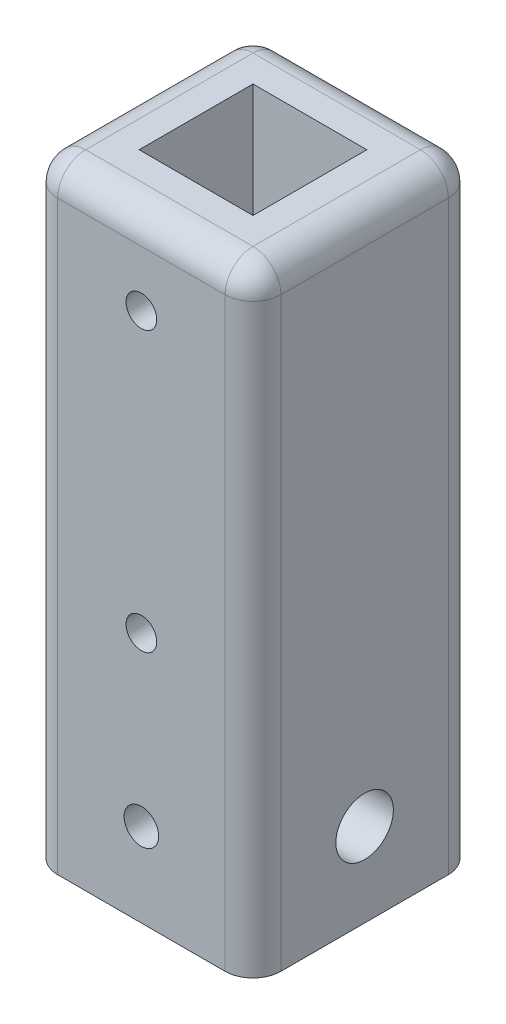
from build123d import *

# Parameters (mm, degrees)
SKETCH1_W               = 40
SKETCH1_H               = 40
SKETCH1_W_2             = 20.4
SKETCH1_H_2             = 20.4
BOSS_EXTRUDE1_DEPTH     = 80
SKETCH1_2_W             = 40
SKETCH1_2_H             = 40
BOSS_EXTRUDE2_DEPTH     = 30
CUT_EXTRUDE1_DEPTH      = 91.68671347
CUT_EXTRUDE1_DEPTH_BACK = 91.68671347
SKETCH2_R               = 2.75
SKETCH3_R               = 5.15
CUT_EXTRUDE4_DEPTH      = 95.403601626
FILLET1_R               = 5
SKETCH4_R               = 3.1
CUT_EXTRUDE6_DEPTH      = 10.5
SKETCH4_3_R             = 2.75
CUT_EXTRUDE7_DEPTH      = 20
FILLET2_R               = 5


with BuildPart() as part:
    # Sketch1 → Boss-Extrude1 (new body)
    with BuildSketch(Plane(origin=(0, 0, 0), x_dir=(1, 0, 0), z_dir=(0, 1, 0))):
        with Locations((10.2, 10.2)):
            Rectangle(SKETCH1_W, SKETCH1_H)
        with Locations((10.2, 10.2)):
            Rectangle(SKETCH1_W_2, SKETCH1_H_2, mode=Mode.SUBTRACT)
    extrude(amount=BOSS_EXTRUDE1_DEPTH)

    # Sketch1<2> → Boss-Extrude2 (add)
    with BuildSketch(Plane(origin=(0, 0, 0), x_dir=(1, 0, 0), z_dir=(0, 1, 0))):
        with Locations((10.2, 10.2)):
            Rectangle(SKETCH1_2_W, SKETCH1_2_H)
    extrude(amount=-BOSS_EXTRUDE2_DEPTH)

    # Sketch2 → Cut-Extrude1 (cut, two sides: drawn at the far end of the back side and taken through both)
    with BuildSketch(Plane(origin=(0, 0, 0), x_dir=(-1, 0, 0), z_dir=(0, 0, -1)).offset(-CUT_EXTRUDE1_DEPTH_BACK)):
        with Locations((-10.2, 15)):
            Circle(SKETCH2_R)
        with Locations((-10.2, 65)):
            Circle(SKETCH2_R)
    extrude(amount=CUT_EXTRUDE1_DEPTH + CUT_EXTRUDE1_DEPTH_BACK, mode=Mode.SUBTRACT)

    # Sketch3 → Cut-Extrude4 (cut, through all)
    with BuildSketch(Plane.ZY.offset(9.8)):
        with Locations((-10.2, -15)):
            Circle(SKETCH3_R)
    extrude(amount=-CUT_EXTRUDE4_DEPTH, mode=Mode.SUBTRACT)

    # Fillet1
    fillet1_edges = [part.edges().sort_by_distance(p)[0] for p in [
        (-9.8, 25, -30.2),
        (-9.8, 25, 9.8),
        (30.2, 25, 9.8),
        (30.2, 25, -30.2),
    ]]
    fillet(fillet1_edges, radius=FILLET1_R)

    # Sketch4 → Cut-Extrude6 (cut)
    with BuildSketch(Plane.XY.offset(9.8)):
        with Locations((10.2, -15)):
            Circle(SKETCH4_R)
    extrude(amount=-CUT_EXTRUDE6_DEPTH, mode=Mode.SUBTRACT)

    # Sketch4<3> → Cut-Extrude7 (cut)
    with BuildSketch(Plane.XY.offset(9.8)):
        with Locations((10.2, -15)):
            Circle(SKETCH4_3_R)
    extrude(amount=-CUT_EXTRUDE7_DEPTH, mode=Mode.SUBTRACT)

    # Fillet2
    fillet2_edges = [part.edges().sort_by_distance(p)[0] for p in [
        (-8.335533906, 80, -28.735533906),
        (10.2, 80, -30.2),
        (28.735533906, 80, -28.735533906),
        (30.2, 80, -10.2),
        (28.735533906, 80, 8.335533906),
        (10.2, 80, 9.8),
        (-8.335533906, 80, 8.335533906),
        (-9.8, 80, -10.2),
    ]]
    fillet(fillet2_edges, radius=FILLET2_R)


solid = part.part
